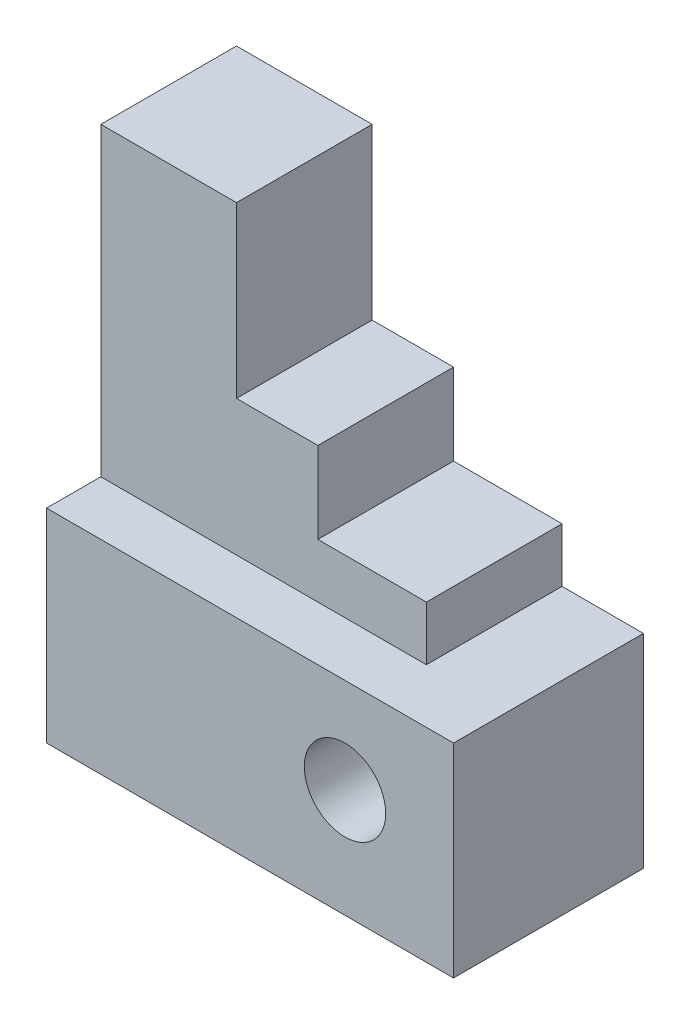
from build123d import *

# Parameters (mm, degrees)
SKETCH1_W           = 60
SKETCH1_H           = 28
BOSS_EXTRUDE1_DEPTH = 30
SKETCH2_W           = 48
SKETCH2_H           = 20
BOSS_EXTRUDE2_DEPTH = 8
SKETCH3_W           = 32
SKETCH3_H           = 20
BOSS_EXTRUDE3_DEPTH = 12
SKETCH4_W           = 20
SKETCH4_H           = 20
BOSS_EXTRUDE4_DEPTH = 25
SKETCH5_R           = 6
CUT_EXTRUDE1_DEPTH  = 101.04498988


with BuildPart() as part:
    # Sketch1 → Boss-Extrude1 (new body)
    with BuildSketch(Plane(origin=(0, 0, 0), x_dir=(1, 0, 0), z_dir=(0, 1, 0))):
        with Locations((30, -14)):
            Rectangle(SKETCH1_W, SKETCH1_H)
    extrude(amount=BOSS_EXTRUDE1_DEPTH)

    # Sketch2 → Boss-Extrude2 (add)
    with BuildSketch(Plane(origin=(0, 30, 0), x_dir=(1, 0, 0), z_dir=(0, 1, 0))):
        with Locations((24, -10)):
            Rectangle(SKETCH2_W, SKETCH2_H)
    extrude(amount=BOSS_EXTRUDE2_DEPTH)

    # Sketch3 → Boss-Extrude3 (add)
    with BuildSketch(Plane(origin=(0, 38, 0), x_dir=(1, 0, 0), z_dir=(0, 1, 0))):
        with Locations((16, -10)):
            Rectangle(SKETCH3_W, SKETCH3_H)
    extrude(amount=BOSS_EXTRUDE3_DEPTH)

    # Sketch4 → Boss-Extrude4 (add)
    with BuildSketch(Plane(origin=(0, 50, 0), x_dir=(1, 0, 0), z_dir=(0, 1, 0))):
        with Locations((10, -10)):
            Rectangle(SKETCH4_W, SKETCH4_H)
    extrude(amount=BOSS_EXTRUDE4_DEPTH)

    # Sketch5 → Cut-Extrude1 (cut, through all)
    with BuildSketch(Plane.XY.offset(28)):
        with Locations((44, 16)):
            Circle(SKETCH5_R)
    extrude(amount=-CUT_EXTRUDE1_DEPTH, mode=Mode.SUBTRACT)


solid = part.part
